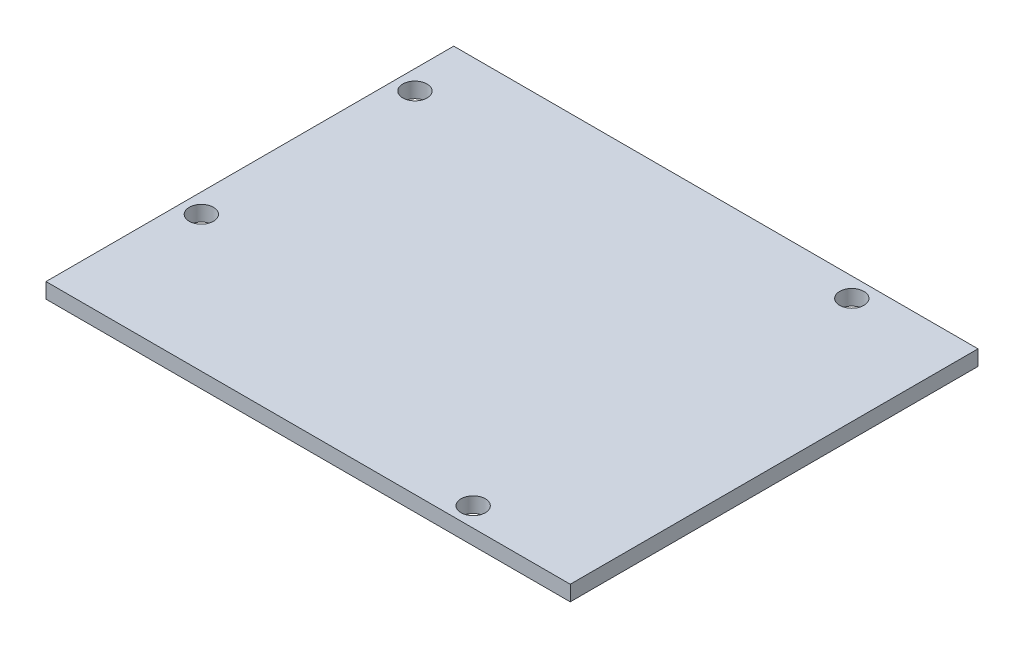
from build123d import *

# Parameters (mm, degrees)
SKETCH1_W           = 68.58
SKETCH1_H           = 53.34
SKETCH1_R           = 1.5875
BOSS_EXTRUDE6_DEPTH = 2


with BuildPart() as part:
    # Sketch1 → Boss-Extrude6 (new body)
    with BuildSketch(Plane(origin=(0, 0, 0), x_dir=(1, 0, 0), z_dir=(0, 1, 0))):
        with Locations((33.760462958, 26.521733282)):
            Rectangle(SKETCH1_W, SKETCH1_H)
        with Locations(Location((2.010462958, 17.631733282, 0), (0, 0, 270))):
            Circle(SKETCH1_R, mode=Mode.SUBTRACT)
        with Locations(Location((2.010462958, 45.571733282, 0), (0, 0, 270))):
            Circle(SKETCH1_R, mode=Mode.SUBTRACT)
        with Locations(Location((52.810462958, 2.391733282, 0), (0, 0, 270))):
            Circle(SKETCH1_R, mode=Mode.SUBTRACT)
        with Locations(Location((54.080462958, 50.651733282, 0), (0, 0, 270))):
            Circle(SKETCH1_R, mode=Mode.SUBTRACT)
    extrude(amount=BOSS_EXTRUDE6_DEPTH)


solid = part.part
